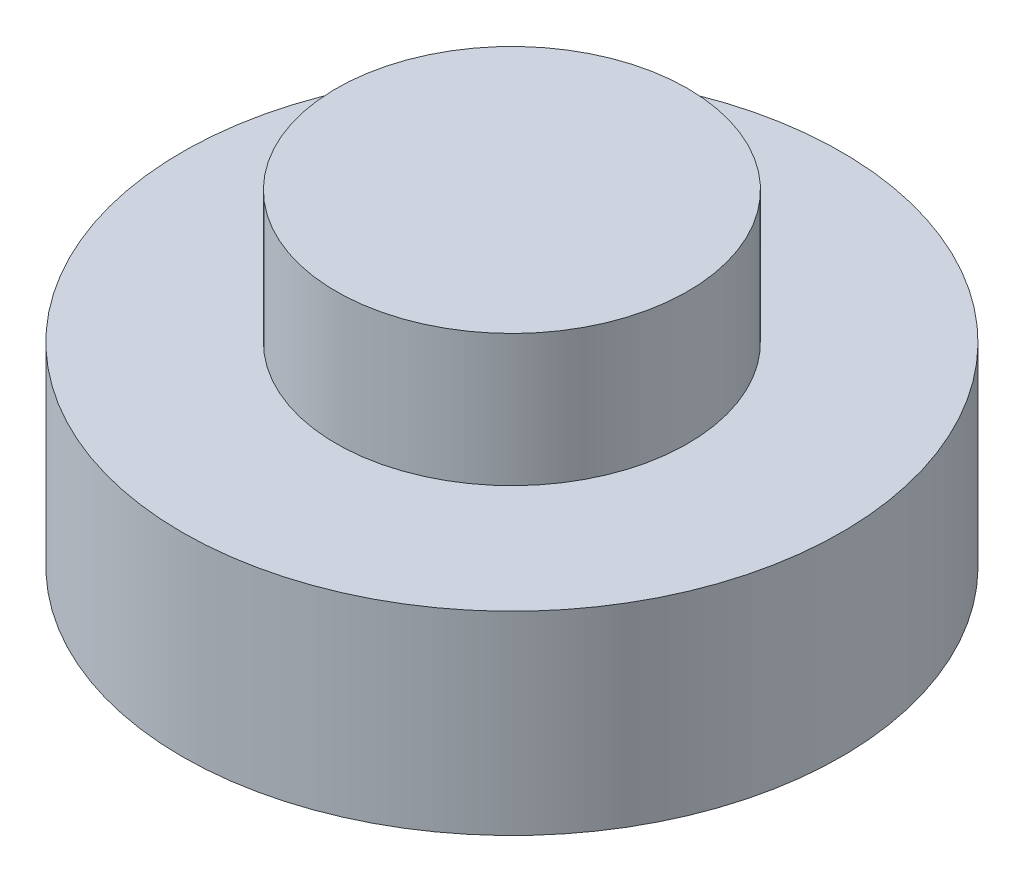
from build123d import *

# Parameters (mm, degrees)
SKETCH1_R           = 7.5
SKETCH1_R_2         = 4
BOSS_EXTRUDE1_DEPTH = 4.42
SKETCH1_2_R         = 4
BOSS_EXTRUDE2_DEPTH = 7.42


with BuildPart() as part:
    # Sketch1 → Boss-Extrude1 (new body)
    with BuildSketch(Plane(origin=(0, 0, 0), x_dir=(1, 0, 0), z_dir=(0, 1, 0))):
        Circle(SKETCH1_R)
        Circle(SKETCH1_R_2, mode=Mode.SUBTRACT)
    extrude(amount=BOSS_EXTRUDE1_DEPTH)

    # Sketch1<2> → Boss-Extrude2 (add)
    with BuildSketch(Plane(origin=(0, 0, 0), x_dir=(1, 0, 0), z_dir=(0, 1, 0))):
        Circle(SKETCH1_2_R)
    extrude(amount=BOSS_EXTRUDE2_DEPTH)


solid = part.part
